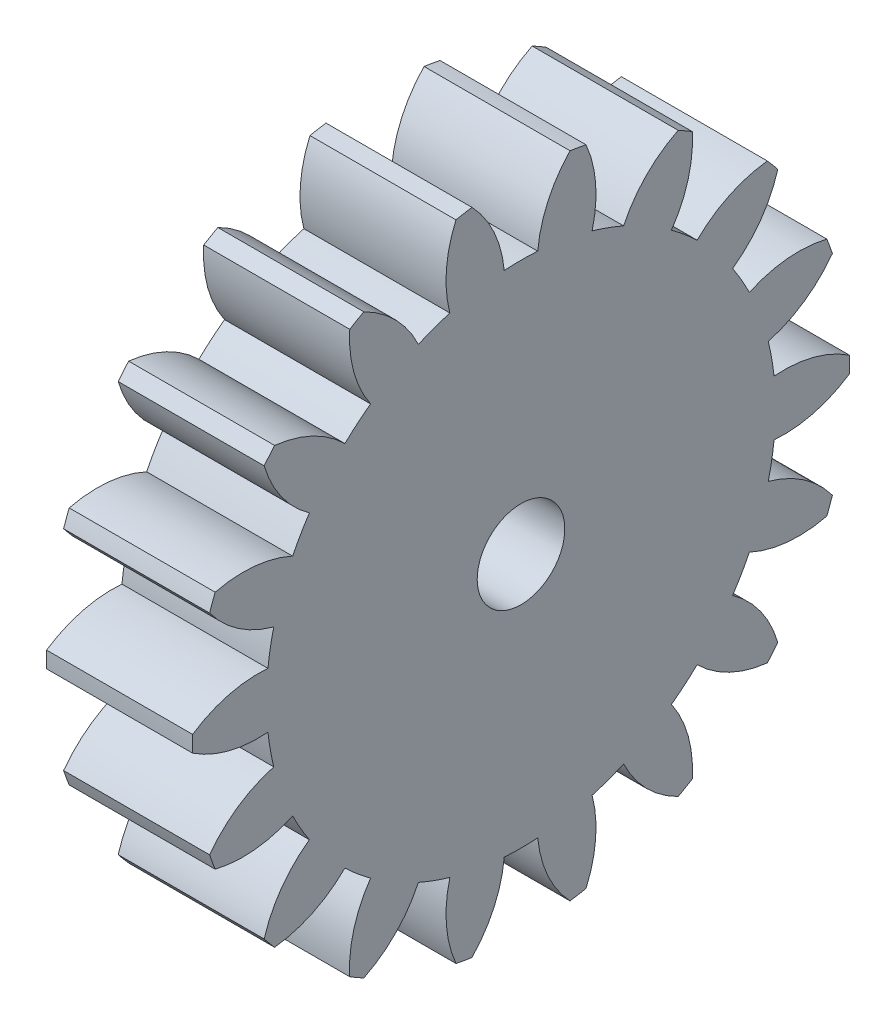
from build123d import *

# Parameters (mm, degrees)
BASPROSKE_W     = 5
BASPROSKE_H     = 11.25
TOOTHCUT_DEPTH  = 17.67708008
TEETHCUTS_COUNT = 18
TEETHCUTS_ANGLE = 340
BORSKE_R        = 1.5
BORE_DEPTH      = 50.0000508


with BuildPart() as part:
    # BasProSke → Base-Revolve (revolve)
    with BuildSketch(Plane(origin=(0, 0, 0), x_dir=(1, 0, 0), z_dir=(0, 1, 0)), mode=Mode.PRIVATE) as base_revolve_sk:
        with Locations((2.5, 5.625)):
            Rectangle(BASPROSKE_W, BASPROSKE_H)
    revolve(base_revolve_sk.sketch.rotate(Axis((-10, 0, 0), (1, 0, 0)), 180), axis=Axis((-10, 0, 0), (1, 0, 0)))

    # TooCutSke → ToothCut (cut, through all)
    with BuildSketch(Plane(origin=(0, 0, 0), x_dir=(0, 0, -1), z_dir=(1, 0, 0))):
        with BuildLine():
            ThreePointArc((0.573352044, 8.698875358), (0, 8.71775), (-0.573352044, 8.698875358))
            ThreePointArc((-0.573352044, 8.698875358), (-0.927373593, 10.019142299), (-1.700441513, 11.146440859))
            ThreePointArc((-1.700441513, 11.146440859), (0, 11.2754), (1.700441513, 11.146440859))
            ThreePointArc((1.700441513, 11.146440859), (0.927373593, 10.019142299), (0.573352044, 8.698875358))
        make_face()
    toothcut = extrude(amount=TOOTHCUT_DEPTH, mode=Mode.SUBTRACT)

    # TeethCuts: ToothCut ×18 about axis
    teethcuts_axis = Axis((-10, 0, 0), (1, 0, 0))
    for i in range(1, TEETHCUTS_COUNT):
        add(toothcut.rotate(teethcuts_axis, i * TEETHCUTS_ANGLE / (TEETHCUTS_COUNT - 1)), mode=Mode.SUBTRACT)

    # BorSke → Bore (cut, symmetric)
    with BuildSketch(Plane(origin=(0, 0, 0), x_dir=(0, 0, -1), z_dir=(1, 0, 0))):
        with Locations(Location((0, 0, 0), (0, 0, 180))):
            Circle(BORSKE_R)
    extrude(amount=BORE_DEPTH, both=True, mode=Mode.SUBTRACT)


solid = part.part
